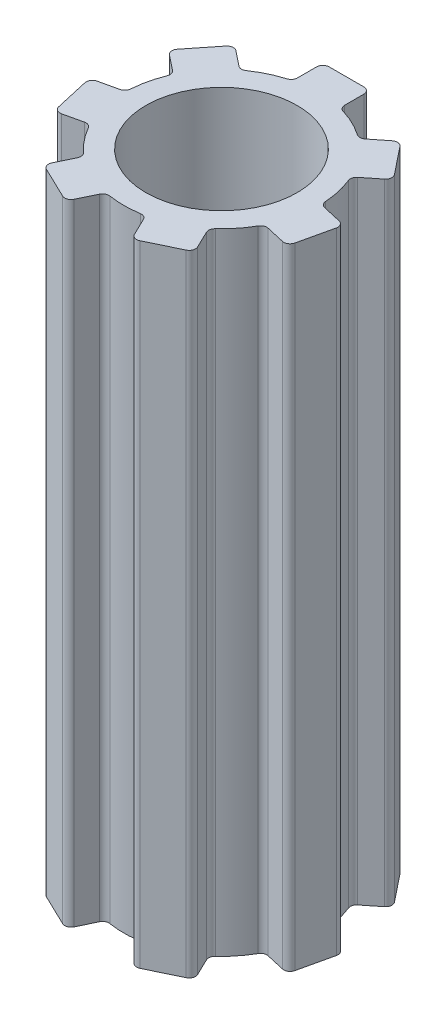
from build123d import *

# Parameters (mm, degrees)
SKETCH1_R                = 3.937
BOSS_EXTRUDE1_DEPTH      = 25.4
SKETCH2_W                = 1.905
SKETCH2_H                = 1.2192
BOSS_EXTRUDE2_DEPTH      = 25.4
FILLET2_R                = 0.254
CIRPATTERN4_COUNT        = 7
FILLET2_OF_CIRPATTERN4_R = 0.254
SKETCH3_R                = 3.048
CUT_EXTRUDE1_DEPTH       = 27.387619956


with BuildPart() as part:
    # Sketch1 → Boss-Extrude1 (new body)
    with BuildSketch(Plane(origin=(0, 0, 0), x_dir=(1, 0, 0), z_dir=(0, 1, 0))):
        with Locations(Location((0, 0, 0), (0, 0, 270))):
            Circle(SKETCH1_R)
    extrude(amount=BOSS_EXTRUDE1_DEPTH)

    # Sketch2 → Boss-Extrude2 (add)
    with BuildSketch(Plane(origin=(0, 25.4, 0), x_dir=(1, 0, 0), z_dir=(0, 1, 0))):
        with Locations((0, 4.429640936)):
            Rectangle(SKETCH2_W, SKETCH2_H)
    boss_extrude2 = extrude(amount=-BOSS_EXTRUDE2_DEPTH)

    # Fillet2
    fillet2_edges = [part.edges().sort_by_distance(p)[0] for p in [
        (0.9525, 12.7, -5.039240936),
        (0.9525, 12.7, -3.820040936),
        (-0.9525, 12.7, -3.820040936),
        (-0.9525, 12.7, -5.039240936),
    ]]
    fillet(fillet2_edges, radius=FILLET2_R)

    # CirPattern4: Boss-Extrude2 ×7 about axis
    cirpattern4_axis = Axis((0, 0, 0), (0, 1, 0))
    for i in range(1, CIRPATTERN4_COUNT):
        add(boss_extrude2.rotate(cirpattern4_axis, i * 360 / CIRPATTERN4_COUNT))

    # Fillet2 of CirPattern4
    fillet2_of_cirpattern4_edges = [part.edges().sort_by_distance(p)[0] for p in [
        (-3.345963175, 12.7, -3.88660982),
        (-2.392754232, 12.7, -3.126451053),
        (-3.580502304, 12.7, -1.637062079),
        (-4.533711247, 12.7, -2.397220845),
        (-5.124847834, 12.7, 0.192717763),
        (-3.936215723, 12.7, -0.07857976),
        (-3.512313344, 12.7, 1.778657913),
        (-4.700945455, 12.7, 2.049955436),
        (-3.044617546, 12.7, 4.126924939),
        (-2.515626491, 12.7, 3.028463696),
        (-0.799280798, 12.7, 3.855012219),
        (-1.328271853, 12.7, 4.953473462),
        (1.328271853, 12.7, 4.953473462),
        (0.799280798, 12.7, 3.855012219),
        (2.515626491, 12.7, 3.028463696),
        (3.044617546, 12.7, 4.126924939),
        (4.700945455, 12.7, 2.049955436),
        (3.512313344, 12.7, 1.778657913),
        (3.936215723, 12.7, -0.07857976),
        (5.124847834, 12.7, 0.192717763),
        (4.533711247, 12.7, -2.397220845),
        (3.580502304, 12.7, -1.637062079),
        (2.392754232, 12.7, -3.126451053),
        (3.345963175, 12.7, -3.88660982),
    ]]
    fillet(fillet2_of_cirpattern4_edges, radius=FILLET2_OF_CIRPATTERN4_R)

    # Sketch3 → Cut-Extrude1 (cut, through all)
    with BuildSketch(Plane(origin=(0, 25.4, 0), x_dir=(1, 0, 0), z_dir=(0, 1, 0))):
        with Locations(Location((0, 0, 0), (0, 0, 270))):
            Circle(SKETCH3_R)
    extrude(amount=-CUT_EXTRUDE1_DEPTH, mode=Mode.SUBTRACT)


solid = part.part
